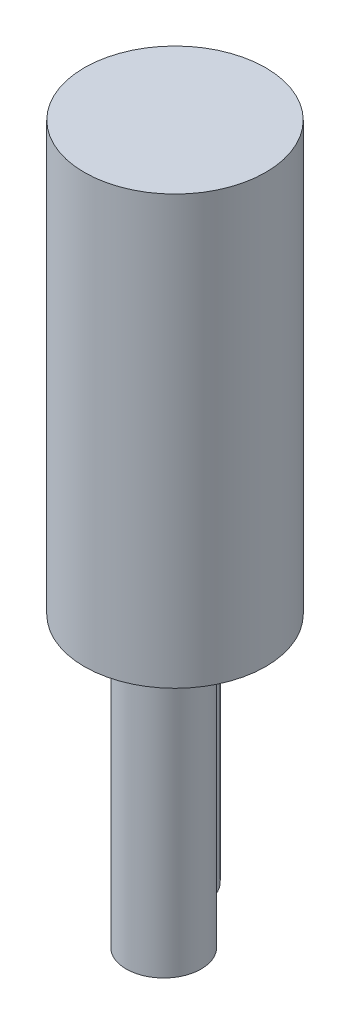
from build123d import *

# Parameters (mm, degrees)
SKETCH1_R           = 169.5
BOSS_EXTRUDE1_DEPTH = 800
SKETCH2_R           = 70
BOSS_EXTRUDE2_DEPTH = 490


with BuildPart() as part:
    # Sketch1 → Boss-Extrude1 (new body)
    with BuildSketch(Plane(origin=(0, 0, 0), x_dir=(1, 0, 0), z_dir=(0, 1, 0))):
        with Locations(Location((0, 0, 0), (0, 0, 270))):
            Circle(SKETCH1_R)
    extrude(amount=BOSS_EXTRUDE1_DEPTH)

    # Sketch2 → Boss-Extrude2 (add)
    with BuildSketch(Plane.XZ):
        with Locations(Location((-63.871878151, -49.558478811, 0), (0, 0, 270))):
            Circle(SKETCH2_R)
        with Locations(Location((38.753875996, 59.90396521, 0), (0, 0, 90))):
            Circle(SKETCH2_R)
    extrude(amount=BOSS_EXTRUDE2_DEPTH)


solid = part.part
